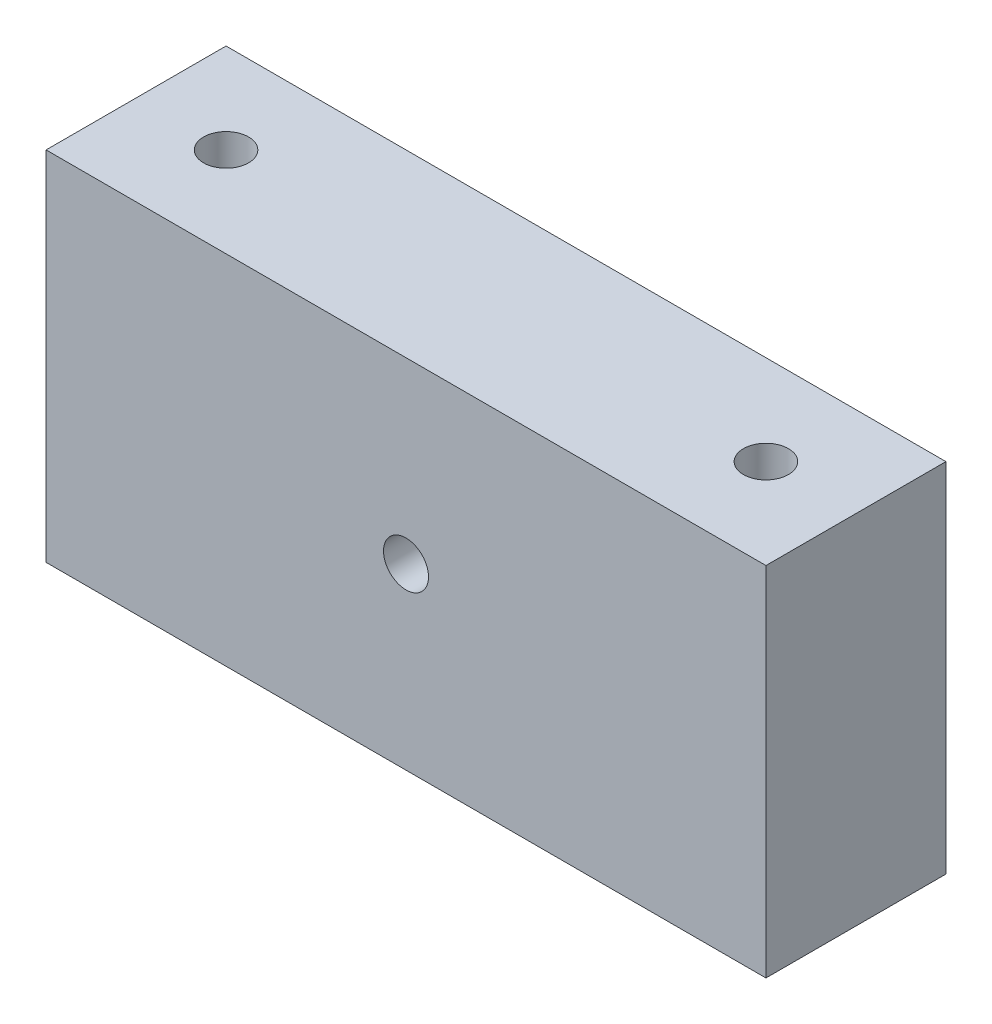
from build123d import *

# Parameters (mm, degrees)
SKETCH1_W             = 40
SKETCH1_H             = 10
BOSS_EXTRUDE1_DEPTH   = 19.85
M3X0_5_TAPPED_HOLE3_D = 2.5
M3X0_5_TAPPED_HOLE4_D = 2.5


with BuildPart() as part:
    # Sketch1 → Boss-Extrude1 (new body)
    with BuildSketch(Plane(origin=(0, 0, 0), x_dir=(1, 0, 0), z_dir=(0, 1, 0))):
        with Locations((20, 5)):
            Rectangle(SKETCH1_W, SKETCH1_H)
    extrude(amount=BOSS_EXTRUDE1_DEPTH)

    # M3x0.5 Tapped Hole3 (through all)
    with Locations(Plane(origin=(5, 19.85, -5), x_dir=(0, 0, 1), z_dir=(0, 1, 0))):
        with Locations((0, 0), (0, 30)):
            Hole(M3X0_5_TAPPED_HOLE3_D / 2)

    # M3x0.5 Tapped Hole4 (through all)
    with Locations(Plane(origin=(20, 9.925, -10), x_dir=(-1, 0, 0), z_dir=(0, 0, -1))):
        with Locations((0, 0)):
            Hole(M3X0_5_TAPPED_HOLE4_D / 2)


solid = part.part
